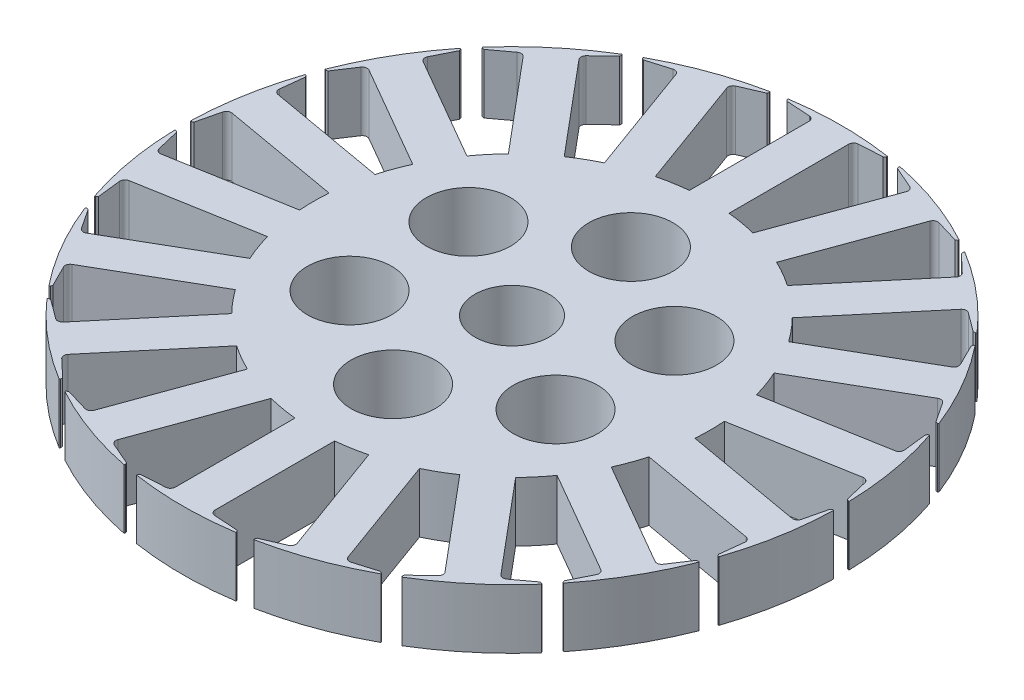
from build123d import *

# Parameters (mm, degrees)
SKETCH1_R           = 7.5
SKETCH1_R_2         = 8.5
BOSS_EXTRUDE1_DEPTH = 12


with BuildPart() as part:
    # Sketch1 → Boss-Extrude1 (new body)
    with BuildSketch(Plane(origin=(0, 0, 0), x_dir=(1, 0, 0), z_dir=(0, 1, 0))):
        with BuildLine():
            Line((-9.700542191, 65.219997393), (-10, 65.538025721))
            Line((-10, 65.538025721), (-10, 65.743821002))
            ThreePointArc((-10, 65.743821002), (0, 66.5), (10, 65.743821002))
            Line((10, 65.743821002), (10, 65.538025721))
            Line((10, 65.538025721), (9.700542191, 65.219997393))
            Line((9.700542191, 65.219997393), (4.939905574, 64.933391686))
            ThreePointArc((4.939905574, 64.933391686), (4.271956586, 64.620730015), (4, 63.935198989))
            Line((4, 63.935198989), (4, 39.799497484))
            ThreePointArc((4, 39.799497484), (6.945927107, 39.39231012), (9.853459351, 38.76737467))
            Line((9.853459351, 38.76737467), (18.108355439, 61.447515272))
            ThreePointArc((18.108355439, 61.447515272), (18.087265261, 62.184718348), (17.566535116, 62.706976222))
            Line((17.566535116, 62.706976222), (13.191024942, 64.604531109))
            Line((13.191024942, 64.604531109), (13.018398743, 65.005800584))
            Line((13.018398743, 65.005800584), (13.088784874, 65.199184892))
            ThreePointArc((13.088784874, 65.199184892), (22.744339531, 62.489559282), (31.88263729, 58.358782025))
            Line((31.88263729, 58.358782025), (31.812251158, 58.165397718))
            Line((31.812251158, 58.165397718), (31.422080771, 57.968969448))
            Line((31.422080771, 57.968969448), (26.850520746, 59.327881797))
            ThreePointArc((26.850520746, 59.327881797), (26.115917421, 59.262527941), (25.625896405, 58.711354125))
            Line((25.625896405, 58.711354125), (17.371000317, 36.031213524))
            ThreePointArc((17.371000317, 36.031213524), (20, 34.641016151), (22.518446082, 33.059334325))
            Line((22.518446082, 33.059334325), (38.032575961, 51.548354344))
            ThreePointArc((38.032575961, 51.548354344), (38.264895979, 52.248311901), (37.954192416, 52.91717397))
            Line((37.954192416, 52.91717397), (34.491559788, 56.196804911))
            Line((34.491559788, 56.196804911), (34.466586466, 56.632916514))
            Line((34.466586466, 56.632916514), (34.598869123, 56.790564845))
            ThreePointArc((34.598869123, 56.790564845), (42.745376044, 50.941955467), (49.919757985, 43.934812651))
            Line((49.919757985, 43.934812651), (49.787475328, 43.77716432))
            Line((49.787475328, 43.77716432), (49.353652669, 43.726028256))
            Line((49.353652669, 43.726028256), (45.522566845, 46.566553778))
            ThreePointArc((45.522566845, 46.566553778), (44.809913186, 46.756390376), (44.160931506, 46.406053467))
            Line((44.160931506, 46.406053467), (28.646801627, 27.917033448))
            ThreePointArc((28.646801627, 27.917033448), (30.641777725, 25.711504387), (32.467375879, 23.363850357))
            Line((32.467375879, 23.363850357), (53.369506521, 35.43170111))
            ThreePointArc((53.369506521, 35.43170111), (53.827215511, 36.009987935), (53.764013967, 36.744779562))
            Line((53.764013967, 36.744779562), (51.631903482, 41.010914665))
            Line((51.631903482, 41.010914665), (51.757595188, 41.429266898))
            Line((51.757595188, 41.429266898), (51.93581913, 41.532164539))
            ThreePointArc((51.93581913, 41.532164539), (57.590689352, 33.25), (61.93581913, 24.211656463))
            Line((61.93581913, 24.211656463), (61.757595188, 24.108758823))
            Line((61.757595188, 24.108758823), (61.332445673, 24.209082729))
            Line((61.332445673, 24.209082729), (58.703919541, 28.188612123))
            ThreePointArc((58.703919541, 28.188612123), (58.099172097, 28.61074208), (57.369506521, 28.503497879))
            Line((57.369506521, 28.503497879), (36.467375879, 16.435647127))
            ThreePointArc((36.467375879, 16.435647127), (37.587704831, 13.680805733), (38.500260978, 10.850341222))
            Line((38.500260978, 10.850341222), (62.269286944, 15.041461805))
            ThreePointArc((62.269286944, 15.041461805), (62.897178448, 15.428327973), (63.089101961, 16.140422445))
            Line((63.089101961, 16.140422445), (62.544677611, 20.878502853))
            Line((62.544677611, 20.878502853), (62.805874071, 21.228636264))
            Line((62.805874071, 21.228636264), (63.008542859, 21.26437224))
            ThreePointArc((63.008542859, 21.26437224), (65.489715575, 11.547603815), (66.481506413, 1.56821718))
            Line((66.481506413, 1.56821718), (66.278837624, 1.532481204))
            Line((66.278837624, 1.532481204), (65.913640558, 1.772164537))
            Line((65.913640558, 1.772164537), (64.804713162, 6.410707827))
            ThreePointArc((64.804713162, 6.410707827), (64.3808134, 7.01421604), (63.658472366, 7.162999781))
            Line((63.658472366, 7.162999781), (39.889446399, 2.971879198))
            ThreePointArc((39.889446399, 2.971879198), (40, 0), (39.889446399, -2.971879198))
            Line((39.889446399, -2.971879198), (63.658472366, -7.162999781))
            ThreePointArc((63.658472366, -7.162999781), (64.3808134, -7.01421604), (64.804713162, -6.410707827))
            Line((64.804713162, -6.410707827), (65.913640558, -1.772164537))
            Line((65.913640558, -1.772164537), (66.278837624, -1.532481204))
            Line((66.278837624, -1.532481204), (66.481506413, -1.56821718))
            ThreePointArc((66.481506413, -1.56821718), (65.489715575, -11.547603815), (63.008542859, -21.26437224))
            Line((63.008542859, -21.26437224), (62.805874071, -21.228636264))
            Line((62.805874071, -21.228636264), (62.544677611, -20.878502853))
            Line((62.544677611, -20.878502853), (63.089101961, -16.140422445))
            ThreePointArc((63.089101961, -16.140422445), (62.897178448, -15.428327973), (62.269286944, -15.041461805))
            Line((62.269286944, -15.041461805), (38.500260978, -10.850341222))
            ThreePointArc((38.500260978, -10.850341222), (37.587704831, -13.680805733), (36.467375879, -16.435647127))
            Line((36.467375879, -16.435647127), (57.369506521, -28.503497879))
            ThreePointArc((57.369506521, -28.503497879), (58.099172097, -28.61074208), (58.703919541, -28.188612123))
            Line((58.703919541, -28.188612123), (61.332445673, -24.209082729))
            Line((61.332445673, -24.209082729), (61.757595188, -24.108758823))
            Line((61.757595188, -24.108758823), (61.93581913, -24.211656463))
            ThreePointArc((61.93581913, -24.211656463), (57.590689352, -33.25), (51.93581913, -41.532164539))
            Line((51.93581913, -41.532164539), (51.757595188, -41.429266898))
            Line((51.757595188, -41.429266898), (51.631903482, -41.010914665))
            Line((51.631903482, -41.010914665), (53.764013967, -36.744779562))
            ThreePointArc((53.764013967, -36.744779562), (53.827215511, -36.009987935), (53.369506521, -35.43170111))
            Line((53.369506521, -35.43170111), (32.467375879, -23.363850357))
            ThreePointArc((32.467375879, -23.363850357), (30.641777725, -25.711504387), (28.646801627, -27.917033448))
            Line((28.646801627, -27.917033448), (44.160931506, -46.406053467))
            ThreePointArc((44.160931506, -46.406053467), (44.809913186, -46.756390376), (45.522566845, -46.566553778))
            Line((45.522566845, -46.566553778), (49.353652669, -43.726028256))
            Line((49.353652669, -43.726028256), (49.787475328, -43.77716432))
            Line((49.787475328, -43.77716432), (49.919757985, -43.934812651))
            ThreePointArc((49.919757985, -43.934812651), (42.745376044, -50.941955467), (34.598869123, -56.790564845))
            Line((34.598869123, -56.790564845), (34.466586466, -56.632916514))
            Line((34.466586466, -56.632916514), (34.491559788, -56.196804911))
            Line((34.491559788, -56.196804911), (37.954192416, -52.91717397))
            ThreePointArc((37.954192416, -52.91717397), (38.264895979, -52.248311901), (38.032575961, -51.548354344))
            Line((38.032575961, -51.548354344), (22.518446082, -33.059334325))
            ThreePointArc((22.518446082, -33.059334325), (20, -34.641016151), (17.371000317, -36.031213524))
            Line((17.371000317, -36.031213524), (25.625896405, -58.711354125))
            ThreePointArc((25.625896405, -58.711354125), (26.115917421, -59.262527941), (26.850520746, -59.327881797))
            Line((26.850520746, -59.327881797), (31.422080771, -57.968969448))
            Line((31.422080771, -57.968969448), (31.812251158, -58.165397718))
            Line((31.812251158, -58.165397718), (31.88263729, -58.358782025))
            ThreePointArc((31.88263729, -58.358782025), (22.744339531, -62.489559282), (13.088784874, -65.199184892))
            Line((13.088784874, -65.199184892), (13.018398743, -65.005800584))
            Line((13.018398743, -65.005800584), (13.191024942, -64.604531109))
            Line((13.191024942, -64.604531109), (17.566535116, -62.706976222))
            ThreePointArc((17.566535116, -62.706976222), (18.087265261, -62.184718348), (18.108355439, -61.447515272))
            Line((18.108355439, -61.447515272), (9.853459351, -38.76737467))
            ThreePointArc((9.853459351, -38.76737467), (6.945927107, -39.39231012), (4, -39.799497484))
            Line((4, -39.799497484), (4, -63.935198989))
            ThreePointArc((4, -63.935198989), (4.271956586, -64.620730015), (4.939905574, -64.933391686))
            Line((4.939905574, -64.933391686), (9.700542191, -65.219997393))
            Line((9.700542191, -65.219997393), (10, -65.538025721))
            Line((10, -65.538025721), (10, -65.743821002))
            ThreePointArc((10, -65.743821002), (0, -66.5), (-10, -65.743821002))
            Line((-10, -65.743821002), (-10, -65.538025721))
            Line((-10, -65.538025721), (-9.700542191, -65.219997393))
            Line((-9.700542191, -65.219997393), (-4.939905574, -64.933391686))
            ThreePointArc((-4.939905574, -64.933391686), (-4.271956586, -64.620730015), (-4, -63.935198989))
            Line((-4, -63.935198989), (-4, -39.799497484))
            ThreePointArc((-4, -39.799497484), (-6.945927107, -39.39231012), (-9.853459351, -38.76737467))
            Line((-9.853459351, -38.76737467), (-18.108355439, -61.447515272))
            ThreePointArc((-18.108355439, -61.447515272), (-18.087265261, -62.184718348), (-17.566535116, -62.706976222))
            Line((-17.566535116, -62.706976222), (-13.191024942, -64.604531109))
            Line((-13.191024942, -64.604531109), (-13.018398743, -65.005800584))
            Line((-13.018398743, -65.005800584), (-13.088784874, -65.199184892))
            ThreePointArc((-13.088784874, -65.199184892), (-22.744339531, -62.489559282), (-31.88263729, -58.358782025))
            Line((-31.88263729, -58.358782025), (-31.812251158, -58.165397718))
            Line((-31.812251158, -58.165397718), (-31.422080771, -57.968969448))
            Line((-31.422080771, -57.968969448), (-26.850520746, -59.327881797))
            ThreePointArc((-26.850520746, -59.327881797), (-26.115917421, -59.262527941), (-25.625896405, -58.711354125))
            Line((-25.625896405, -58.711354125), (-17.371000317, -36.031213524))
            ThreePointArc((-17.371000317, -36.031213524), (-20, -34.641016151), (-22.518446082, -33.059334325))
            Line((-22.518446082, -33.059334325), (-38.032575961, -51.548354344))
            ThreePointArc((-38.032575961, -51.548354344), (-38.264895979, -52.248311901), (-37.954192416, -52.91717397))
            Line((-37.954192416, -52.91717397), (-34.491559788, -56.196804911))
            Line((-34.491559788, -56.196804911), (-34.466586466, -56.632916514))
            Line((-34.466586466, -56.632916514), (-34.598869123, -56.790564845))
            ThreePointArc((-34.598869123, -56.790564845), (-42.745376044, -50.941955467), (-49.919757985, -43.934812651))
            Line((-49.919757985, -43.934812651), (-49.787475328, -43.77716432))
            Line((-49.787475328, -43.77716432), (-49.353652669, -43.726028256))
            Line((-49.353652669, -43.726028256), (-45.522566845, -46.566553778))
            ThreePointArc((-45.522566845, -46.566553778), (-44.809913186, -46.756390376), (-44.160931506, -46.406053467))
            Line((-44.160931506, -46.406053467), (-28.646801627, -27.917033448))
            ThreePointArc((-28.646801627, -27.917033448), (-30.641777725, -25.711504387), (-32.467375879, -23.363850357))
            Line((-32.467375879, -23.363850357), (-53.369506521, -35.43170111))
            ThreePointArc((-53.369506521, -35.43170111), (-53.827215511, -36.009987935), (-53.764013967, -36.744779562))
            Line((-53.764013967, -36.744779562), (-51.631903482, -41.010914665))
            Line((-51.631903482, -41.010914665), (-51.757595188, -41.429266898))
            Line((-51.757595188, -41.429266898), (-51.93581913, -41.532164539))
            ThreePointArc((-51.93581913, -41.532164539), (-57.590689352, -33.25), (-61.93581913, -24.211656463))
            Line((-61.93581913, -24.211656463), (-61.757595188, -24.108758823))
            Line((-61.757595188, -24.108758823), (-61.332445673, -24.209082729))
            Line((-61.332445673, -24.209082729), (-58.703919541, -28.188612123))
            ThreePointArc((-58.703919541, -28.188612123), (-58.099172097, -28.61074208), (-57.369506521, -28.503497879))
            Line((-57.369506521, -28.503497879), (-36.467375879, -16.435647127))
            ThreePointArc((-36.467375879, -16.435647127), (-37.587704831, -13.680805733), (-38.500260978, -10.850341222))
            Line((-38.500260978, -10.850341222), (-62.269286944, -15.041461805))
            ThreePointArc((-62.269286944, -15.041461805), (-62.897178448, -15.428327973), (-63.089101961, -16.140422445))
            Line((-63.089101961, -16.140422445), (-62.544677611, -20.878502853))
            Line((-62.544677611, -20.878502853), (-62.805874071, -21.228636264))
            Line((-62.805874071, -21.228636264), (-63.008542859, -21.26437224))
            ThreePointArc((-63.008542859, -21.26437224), (-65.489715575, -11.547603815), (-66.481506413, -1.56821718))
            Line((-66.481506413, -1.56821718), (-66.278837624, -1.532481204))
            Line((-66.278837624, -1.532481204), (-65.913640558, -1.772164537))
            Line((-65.913640558, -1.772164537), (-64.804713162, -6.410707827))
            ThreePointArc((-64.804713162, -6.410707827), (-64.3808134, -7.01421604), (-63.658472366, -7.162999781))
            Line((-63.658472366, -7.162999781), (-39.889446399, -2.971879198))
            ThreePointArc((-39.889446399, -2.971879198), (-40, 0), (-39.889446399, 2.971879198))
            Line((-39.889446399, 2.971879198), (-63.658472366, 7.162999781))
            ThreePointArc((-63.658472366, 7.162999781), (-64.3808134, 7.01421604), (-64.804713162, 6.410707827))
            Line((-64.804713162, 6.410707827), (-65.913640558, 1.772164537))
            Line((-65.913640558, 1.772164537), (-66.278837624, 1.532481204))
            Line((-66.278837624, 1.532481204), (-66.481506413, 1.56821718))
            ThreePointArc((-66.481506413, 1.56821718), (-65.489715575, 11.547603815), (-63.008542859, 21.26437224))
            Line((-63.008542859, 21.26437224), (-62.805874071, 21.228636264))
            Line((-62.805874071, 21.228636264), (-62.544677611, 20.878502853))
            Line((-62.544677611, 20.878502853), (-63.089101961, 16.140422445))
            ThreePointArc((-63.089101961, 16.140422445), (-62.897178448, 15.428327973), (-62.269286944, 15.041461805))
            Line((-62.269286944, 15.041461805), (-38.500260978, 10.850341222))
            ThreePointArc((-38.500260978, 10.850341222), (-37.587704831, 13.680805733), (-36.467375879, 16.435647127))
            Line((-36.467375879, 16.435647127), (-57.369506521, 28.503497879))
            ThreePointArc((-57.369506521, 28.503497879), (-58.099172097, 28.61074208), (-58.703919541, 28.188612123))
            Line((-58.703919541, 28.188612123), (-61.332445673, 24.209082729))
            Line((-61.332445673, 24.209082729), (-61.757595188, 24.108758823))
            Line((-61.757595188, 24.108758823), (-61.93581913, 24.211656463))
            ThreePointArc((-61.93581913, 24.211656463), (-57.590689352, 33.25), (-51.93581913, 41.532164539))
            Line((-51.93581913, 41.532164539), (-51.757595188, 41.429266898))
            Line((-51.757595188, 41.429266898), (-51.631903482, 41.010914665))
            Line((-51.631903482, 41.010914665), (-53.764013967, 36.744779562))
            ThreePointArc((-53.764013967, 36.744779562), (-53.827215511, 36.009987935), (-53.369506521, 35.43170111))
            Line((-53.369506521, 35.43170111), (-32.467375879, 23.363850357))
            ThreePointArc((-32.467375879, 23.363850357), (-30.641777725, 25.711504387), (-28.646801627, 27.917033448))
            Line((-28.646801627, 27.917033448), (-44.160931506, 46.406053467))
            ThreePointArc((-44.160931506, 46.406053467), (-44.809913186, 46.756390376), (-45.522566845, 46.566553778))
            Line((-45.522566845, 46.566553778), (-49.353652669, 43.726028256))
            Line((-49.353652669, 43.726028256), (-49.787475328, 43.77716432))
            Line((-49.787475328, 43.77716432), (-49.919757985, 43.934812651))
            ThreePointArc((-49.919757985, 43.934812651), (-42.745376044, 50.941955467), (-34.598869123, 56.790564845))
            Line((-34.598869123, 56.790564845), (-34.466586466, 56.632916514))
            Line((-34.466586466, 56.632916514), (-34.491559788, 56.196804911))
            Line((-34.491559788, 56.196804911), (-37.954192416, 52.91717397))
            ThreePointArc((-37.954192416, 52.91717397), (-38.264895979, 52.248311901), (-38.032575961, 51.548354344))
            Line((-38.032575961, 51.548354344), (-22.518446082, 33.059334325))
            ThreePointArc((-22.518446082, 33.059334325), (-20, 34.641016151), (-17.371000317, 36.031213524))
            Line((-17.371000317, 36.031213524), (-25.625896405, 58.711354125))
            ThreePointArc((-25.625896405, 58.711354125), (-26.115917421, 59.262527941), (-26.850520746, 59.327881797))
            Line((-26.850520746, 59.327881797), (-31.422080771, 57.968969448))
            Line((-31.422080771, 57.968969448), (-31.812251158, 58.165397718))
            Line((-31.812251158, 58.165397718), (-31.88263729, 58.358782025))
            ThreePointArc((-31.88263729, 58.358782025), (-22.744339531, 62.489559282), (-13.088784874, 65.199184892))
            Line((-13.088784874, 65.199184892), (-13.018398743, 65.005800584))
            Line((-13.018398743, 65.005800584), (-13.191024942, 64.604531109))
            Line((-13.191024942, 64.604531109), (-17.566535116, 62.706976222))
            ThreePointArc((-17.566535116, 62.706976222), (-18.087265261, 62.184718348), (-18.108355439, 61.447515272))
            Line((-18.108355439, 61.447515272), (-9.853459351, 38.76737467))
            ThreePointArc((-9.853459351, 38.76737467), (-6.945927107, 39.39231012), (-4, 39.799497484))
            Line((-4, 39.799497484), (-4, 63.935198989))
            ThreePointArc((-4, 63.935198989), (-4.271956586, 64.620730015), (-4.939905574, 64.933391686))
            Line((-4.939905574, 64.933391686), (-9.700542191, 65.219997393))
        make_face()
        with Locations(Location((0, 0, 0), (0, 0, 270))):
            Circle(SKETCH1_R, mode=Mode.SUBTRACT)
        with Locations(Location((0, 24, 0), (0, 0, 270))):
            Circle(SKETCH1_R_2, mode=Mode.SUBTRACT)
        with Locations(Location((20.784609691, 12, 0), (0, 0, 270))):
            Circle(SKETCH1_R_2, mode=Mode.SUBTRACT)
        with Locations(Location((20.784609691, -12, 0), (0, 0, 270))):
            Circle(SKETCH1_R_2, mode=Mode.SUBTRACT)
        with Locations(Location((0, -24, 0), (0, 0, 270))):
            Circle(SKETCH1_R_2, mode=Mode.SUBTRACT)
        with Locations(Location((-20.784609691, -12, 0), (0, 0, 270))):
            Circle(SKETCH1_R_2, mode=Mode.SUBTRACT)
        with Locations(Location((-20.784609691, 12, 0), (0, 0, 270))):
            Circle(SKETCH1_R_2, mode=Mode.SUBTRACT)
    extrude(amount=BOSS_EXTRUDE1_DEPTH)


solid = part.part
